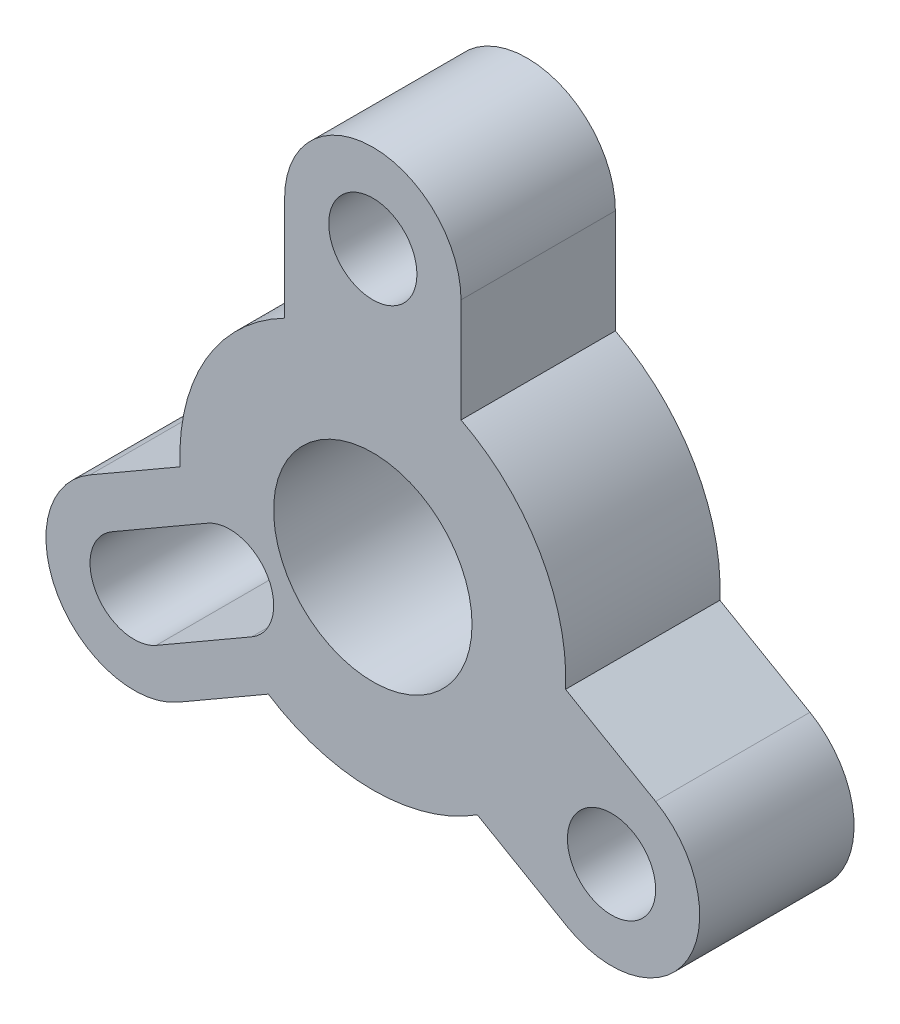
from build123d import *

# Parameters (mm, degrees)
SKETCH_1_R      = 9
SKETCH_1_R_2    = 4
EXTRUDE_1_DEPTH = 14


with BuildPart() as part:
    # Эскиз1 → Бобышка-Вытянуть1 (new body)
    with BuildSketch(Plane.XY):
        with BuildLine():
            Line((-8, 25), (-8, 15.564382416))
            ThreePointArc((-8, 15.564382416), (-15.155444566, 8.75), (-17.479150567, -0.853987978))
            Line((-17.479150567, -0.853987978), (-25.650635095, -5.57179677))
            ThreePointArc((-25.650635095, -5.57179677), (-28.578838325, -16.5), (-17.650635095, -19.42820323))
            Line((-17.650635095, -19.42820323), (-9.479150567, -14.710394438))
            ThreePointArc((-9.479150567, -14.710394438), (0, -17.5), (9.479150567, -14.710394438))
            Line((9.479150567, -14.710394438), (17.650635095, -19.42820323))
            ThreePointArc((17.650635095, -19.42820323), (28.578838325, -16.5), (25.650635095, -5.57179677))
            Line((25.650635095, -5.57179677), (17.479150567, -0.853987978))
            ThreePointArc((17.479150567, -0.853987978), (15.155444566, 8.75), (8, 15.564382416))
            Line((8, 15.564382416), (8, 25))
            ThreePointArc((8, 25), (0, 33), (-8, 25))
        make_face()
        Circle(SKETCH_1_R, mode=Mode.SUBTRACT)
        with Locations((0, 25)):
            Circle(SKETCH_1_R_2, mode=Mode.SUBTRACT)
        with Locations((21.650635095, -12.5)):
            Circle(SKETCH_1_R_2, mode=Mode.SUBTRACT)
        with BuildLine():
            Line((-14.990381057, -4.035898385), (-23.650635095, -9.035898385))
            ThreePointArc((-23.650635095, -9.035898385), (-25.11473671, -14.5), (-19.650635095, -15.964101615))
            Line((-19.650635095, -15.964101615), (-10.990381057, -10.964101615))
            ThreePointArc((-10.990381057, -10.964101615), (-9.526279442, -5.5), (-14.990381057, -4.035898385))
        make_face(mode=Mode.SUBTRACT)
    extrude(amount=EXTRUDE_1_DEPTH)


solid = part.part
